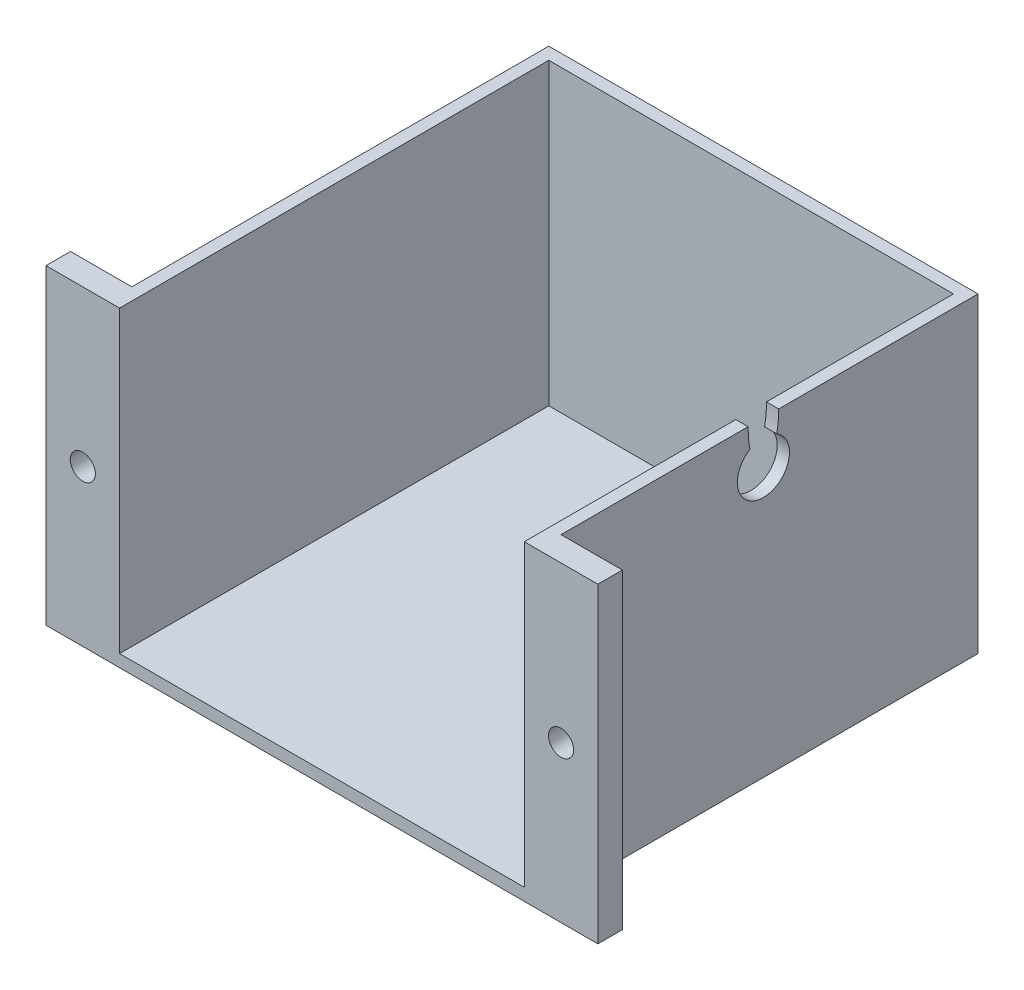
from build123d import *

# Parameters (mm, degrees)
BOSS_EXTRUDE1_DEPTH             = 50.8
BOTTOMCOVERSKETCH3_W            = 66
BOTTOMCOVERSKETCH3_H            = 2
BOTTOMCOVERBOSS_EXTRUDE2_DEPTH  = 70
MOUNTINGHOLESSKETCH4_R          = 2.05
MOUNTINGHOLESCUT_EXTRUDE2_DEPTH = 4
CABLEHOLECUT_EXTRUDE1_REACH     = 118.639


with BuildPart() as part:
    # Sketch1 → Boss-Extrude1 (new body)
    with BuildSketch(Plane(origin=(0, 0, 0), x_dir=(1, 0, 0), z_dir=(0, 1, 0))):
        Polygon((-10, 0), (0, 0), (0, 68), (70, 68), (70, 0), (80, 0), (80, -4), (68, -4), (68, 66), (2, 66), (2, -4), (-10, -4), align=None)
    extrude(amount=BOSS_EXTRUDE1_DEPTH)

    # BottomCoverSketch3 → BottomCoverBoss-Extrude2 (add)
    with BuildSketch(Plane.XY.offset(-66)):
        with Locations((35, 1)):
            Rectangle(BOTTOMCOVERSKETCH3_W, BOTTOMCOVERSKETCH3_H)
    extrude(amount=BOTTOMCOVERBOSS_EXTRUDE2_DEPTH)

    # MountingHolesSketch4 → MountingHolesCut-Extrude2 (cut)
    with BuildSketch(Plane.XY.offset(4)):
        with Locations((74, 25.4)):
            Circle(MOUNTINGHOLESSKETCH4_R)
        with Locations((-4, 25.4)):
            Circle(MOUNTINGHOLESSKETCH4_R)
    extrude(amount=-MOUNTINGHOLESCUT_EXTRUDE2_DEPTH, mode=Mode.SUBTRACT)

    # CableHoleSketch2 → CableHoleCut-Extrude1 (cut, up to next)
    with BuildSketch(Plane(origin=(70, 0, 0), x_dir=(0, 0, -1), z_dir=(1, 0, 0)), mode=Mode.PRIVATE) as cableholecut_extrude1_sk1:
        with BuildLine():
            Line((30.5, 50.8), (35.5, 50.8))
            add(Edge.make_bspline(
                [(35.193240855, 47.440356377), (35.5, 49.010381841), (35.5, 50.8)],
                knots=[1.070199647, 1.070199647, 1.070199647, 1.570796327, 1.570796327, 1.570796327], degree=2, weights=[1, 0.968838568, 1]))
            ThreePointArc((35.193240855, 47.440356377), (33, 39.55), (30.806759145, 47.440356377))
            add(Edge.make_bspline(
                [(30.5, 50.8), (30.5, 49.010381841), (30.806759145, 47.440356377)],
                knots=[4.71238898, 4.71238898, 4.71238898, 5.21298566, 5.21298566, 5.21298566], degree=2, weights=[1, 0.968838568, 1]))
        make_face()
    cableholecut_extrude1_tool1 = extrude(cableholecut_extrude1_sk1.sketch, amount=-CABLEHOLECUT_EXTRUDE1_REACH, mode=Mode.PRIVATE) & part.part
    add(cableholecut_extrude1_tool1.solids().sort_by_distance((70, 44.916526, -33))[0], mode=Mode.SUBTRACT)


solid = part.part
